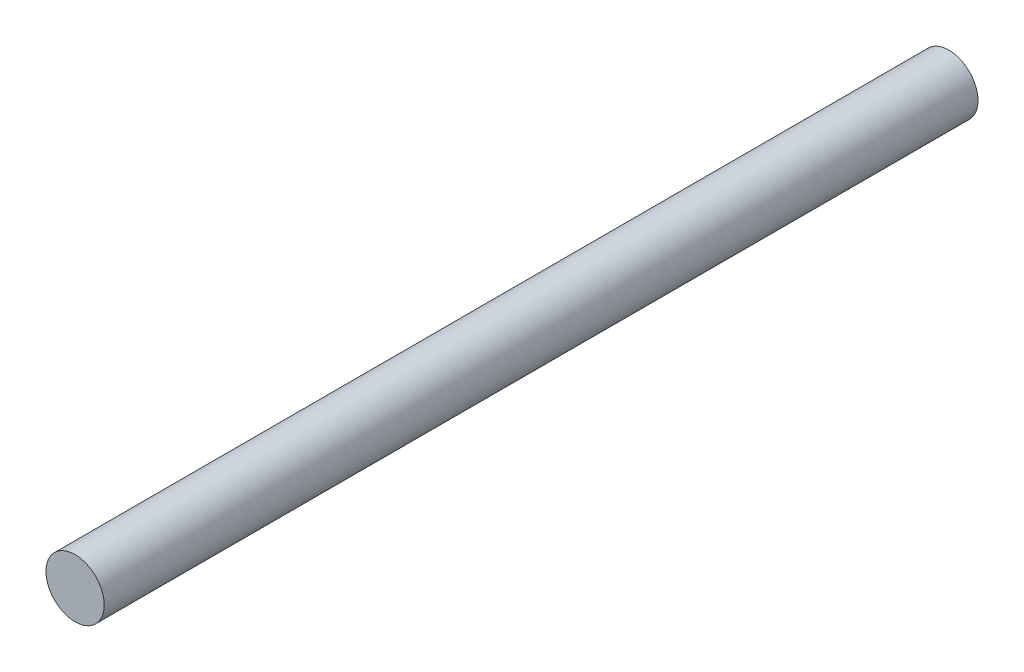
from build123d import *

# Parameters (mm, degrees)
CROQUIS1_R              = 5
SALIENTE_EXTRUIR1_DEPTH = 150


with BuildPart() as part:
    # Croquis1 → Saliente-Extruir1 (new body)
    with BuildSketch(Plane.XY):
        Circle(CROQUIS1_R)
    extrude(amount=SALIENTE_EXTRUIR1_DEPTH)


solid = part.part
